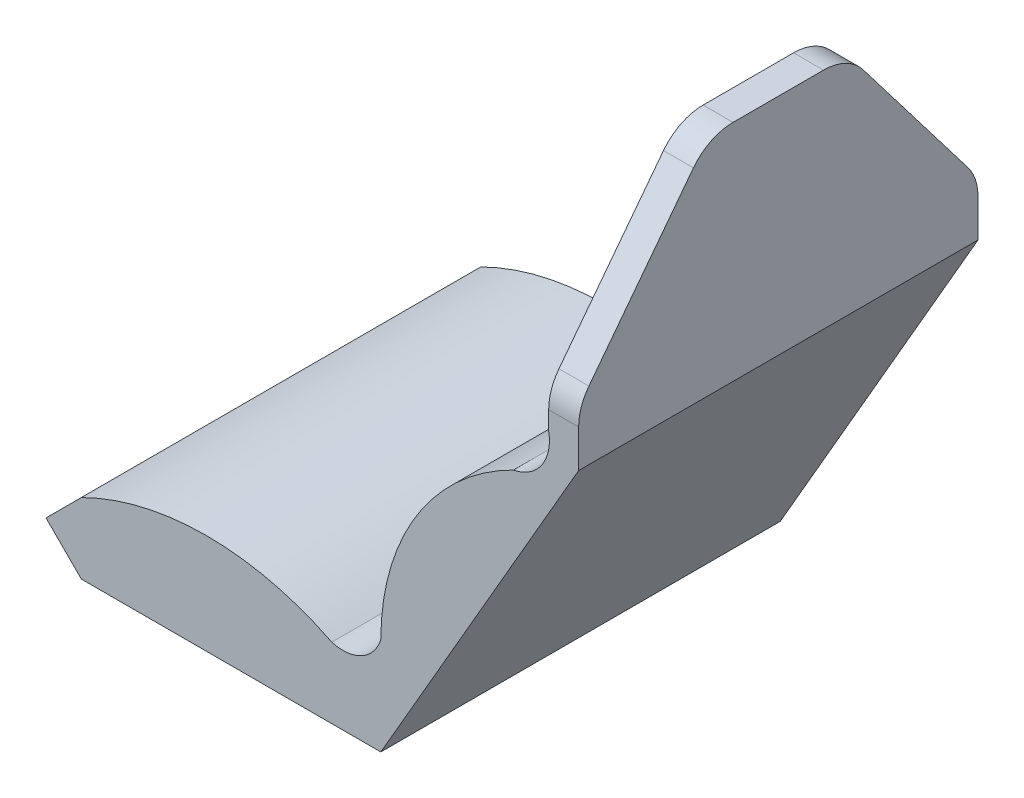
from build123d import *

# Parameters (mm, degrees)
BOSS_EXTRUDE1_DEPTH = 200
CHAMFER1_SIZE       = 130
CHAMFER1_SIZE2      = 170
CHAMFER2_SIZE       = 170
CHAMFER2_SIZE2      = 130
FILLET1_R           = 50
SKETCH2_R           = 20
BOSS_EXTRUDE2_DEPTH = 10


with BuildPart() as part:
    # Sketch1 → Boss-Extrude1 (new body)
    with BuildSketch(Plane.XY):
        with BuildLine():
            Line((0, 0), (-300, 0))
            Line((-300, 0), (-335.355339059, 35.355339059))
            Line((-335.355339059, 35.355339059), (-300, 70.710678119))
            ThreePointArc((-300, 70.710678119), (-174.539840649, 100.365711492), (-49.079681299, 70.710678119))
            ThreePointArc((-49.079681299, 70.710678119), (-18.96069104, 74.015201956), (0, 97.649195424))
            ThreePointArc((0, 97.649195424), (36.003553141, 223.252657901), (132.842160393, 310.972494714))
            ThreePointArc((132.842160393, 310.972494714), (161.131495087, 329.380753651), (168.11847076, 362.400938773))
            Line((168.11847076, 362.400938773), (168.11847076, 567.864757456))
            Line((168.11847076, 567.864757456), (198.11847076, 567.864757456))
            Line((198.11847076, 567.864757456), (198.11847076, 343.151257275))
            Line((198.11847076, 343.151257275), (0, 0))
        make_face()
    extrude(amount=-BOSS_EXTRUDE1_DEPTH)

    # Mirror1: part across plane


with BuildPart() as part_1:
    add(part.part)
    add(part.part.mirror(Plane(origin=(-174.539840649, -179.851012248, -200), x_dir=(1, 0, 0), z_dir=(0, 0, -1))))

    # Chamfer1
    chamfer1_edges = [part_1.edges().sort_by_distance(p)[0] for p in [
        (183.11847076, 567.864757456, 0),
    ]]
    chamfer1_side = [part_1.faces().sort_by_distance(p)[0] for p in [
        (183.11847076, 567.864757456, -200),
    ]]
    chamfer(chamfer1_edges, length=CHAMFER1_SIZE, length2=CHAMFER1_SIZE2, reference=chamfer1_side[0])

    # Chamfer2
    chamfer2_edges = [part_1.edges().sort_by_distance(p)[0] for p in [
        (183.11847076, 567.864757456, -400),
    ]]
    chamfer2_side = [part_1.faces().sort_by_distance(p)[0] for p in [
        (190.327035151, 455.508007366, -400),
    ]]
    chamfer(chamfer2_edges, length=CHAMFER2_SIZE, length2=CHAMFER2_SIZE2, reference=chamfer2_side[0])

    # Fillet1
    fillet1_edges = [part_1.edges().sort_by_distance(p)[0] for p in [
        (183.11847076, 397.864757456, 0),
        (183.11847076, 567.864757456, -130),
        (183.11847076, 567.864757456, -270),
        (183.11847076, 397.864757456, -400),
    ]]
    fillet(fillet1_edges, radius=FILLET1_R)

    # Sketch2 → Boss-Extrude2 (add)
    with BuildSketch(Plane.XZ):
        with Locations((-150, -200)):
            Circle(SKETCH2_R)
    extrude(amount=BOSS_EXTRUDE2_DEPTH)


solid = part_1.part
